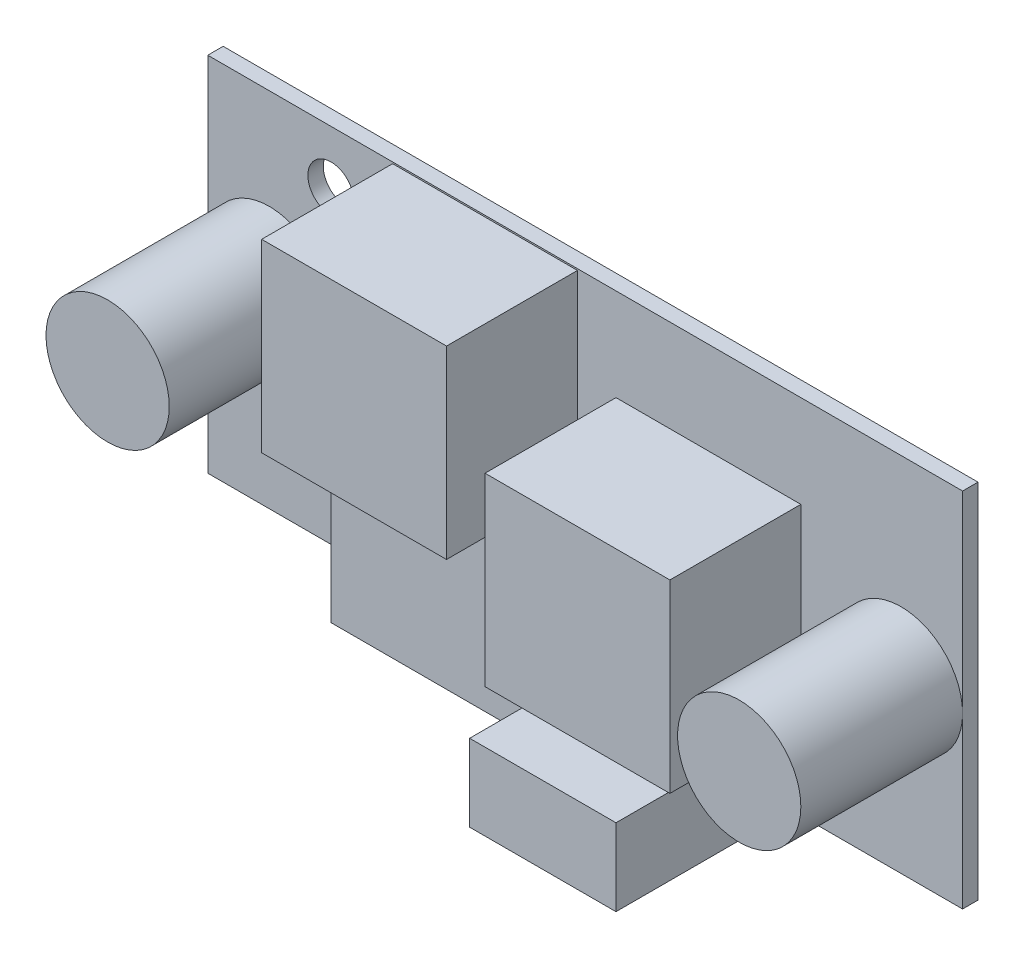
from build123d import *

# Parameters (mm, degrees)
SKETCH_1_W         = 49
SKETCH_1_H         = 23.5
SKETCH_1_R         = 1.5
EXTRUDE_512_DEPTH  = 1
SKETCH_2_R         = 4
EXTRUDE_1244_DEPTH = 10.5
SKETCH_2_3_W       = 9.5
SKETCH_2_3_H       = 5
EXTRUDE_1289_DEPTH = 11.5
SKETCH_2_5_W       = 12
SKETCH_2_5_H       = 12
EXTRUDE_1429_DEPTH = 8.5
SKETCH_2_6_W       = 13
SKETCH_2_6_H       = 10
EXTRUDE_1653_DEPTH = 4.5


with BuildPart() as part:
    # Эскиз1 → Extrude 512 (new body)
    with BuildSketch(Plane.XY):
        Rectangle(SKETCH_1_W, SKETCH_1_H)
        with Locations((-16.5, 8.25)):
            Circle(SKETCH_1_R, mode=Mode.SUBTRACT)
        with Locations((16.5, -8.25)):
            Circle(SKETCH_1_R, mode=Mode.SUBTRACT)
    extrude(amount=EXTRUDE_512_DEPTH)

    # Эскиз2 → Extrude 1244 (add)
    with BuildSketch(Plane.XY.offset(1)):
        with Locations((-20.5, 1.25)):
            Circle(SKETCH_2_R)
        with Locations((20.5, -0.75)):
            Circle(SKETCH_2_R)
    extrude(amount=EXTRUDE_1244_DEPTH)

    # Эскиз2<3> → Extrude 1289 (add)
    with BuildSketch(Plane.XY.offset(1)):
        with Locations((8.75, -9.15)):
            Rectangle(SKETCH_2_3_W, SKETCH_2_3_H)
    extrude(amount=EXTRUDE_1289_DEPTH)

    # Эскиз2<5> → Extrude 1429 (add)
    with BuildSketch(Plane.XY.offset(1)):
        with Locations((-6.5, 5.65)):
            Rectangle(SKETCH_2_5_W, SKETCH_2_5_H)
        with Locations((8, -0.25)):
            Rectangle(SKETCH_2_5_W, SKETCH_2_5_H)
    extrude(amount=EXTRUDE_1429_DEPTH)

    # Эскиз2<6> → Extrude 1653 (add)
    with BuildSketch(Plane.XY.offset(1)):
        with Locations((-5.5, -6.65)):
            Rectangle(SKETCH_2_6_W, SKETCH_2_6_H)
    extrude(amount=EXTRUDE_1653_DEPTH)


solid = part.part
